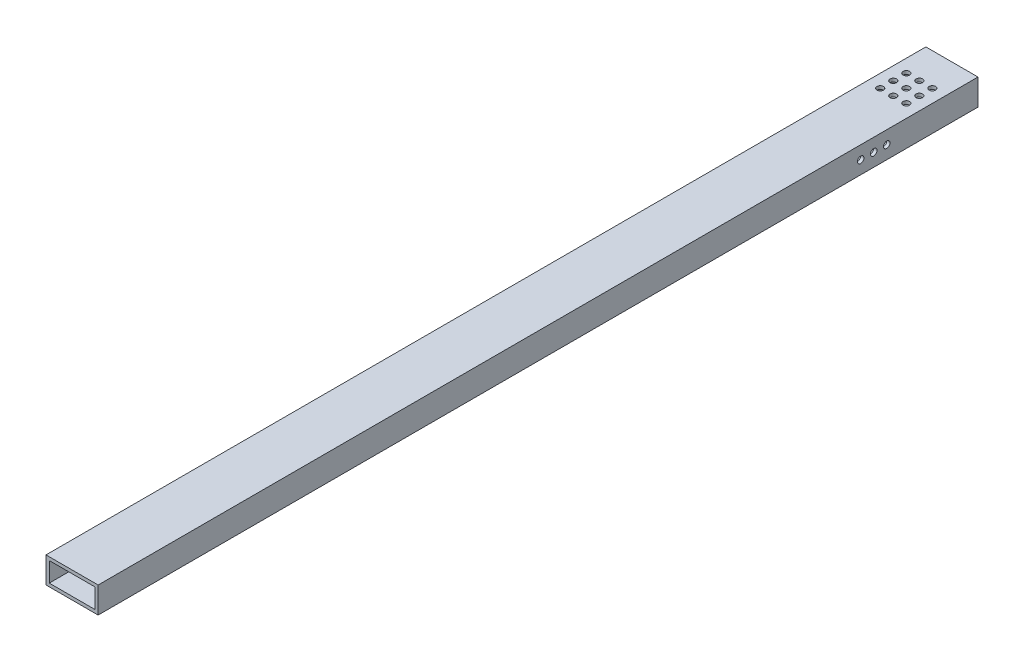
from build123d import *

# Parameters (mm, degrees)
SKETCH1_W               = 50.8
SKETCH1_H               = 25.4
SKETCH1_W_2             = 44.45
SKETCH1_H_2             = 19.05
BOSS_EXTRUDE1_DEPTH     = 857.25
CUT_EXTRUDE1_DEPTH      = 860.129421275
CUT_EXTRUDE1_DEPTH_BACK = 860.129421275
SKETCH2_R               = 3.175
CUT_EXTRUDE2_DEPTH      = 860.129421275
CUT_EXTRUDE2_DEPTH_BACK = 860.129421275
SKETCH3_R               = 3.175


with BuildPart() as part:
    # Sketch1 → Boss-Extrude1 (new body)
    with BuildSketch(Plane.XY):
        with Locations((25.4, 12.7)):
            Rectangle(SKETCH1_W, SKETCH1_H)
        with Locations((25.4, 12.7)):
            Rectangle(SKETCH1_W_2, SKETCH1_H_2, mode=Mode.SUBTRACT)
    extrude(amount=BOSS_EXTRUDE1_DEPTH)

    # Sketch2 → Cut-Extrude1 (cut, two sides: drawn at the far end of the back side and taken through both)
    with BuildSketch(Plane(origin=(50.8, 0, 0), x_dir=(0, 0, -1), z_dir=(1, 0, 0)).offset(-CUT_EXTRUDE1_DEPTH_BACK)):
        with Locations((-88.9, 12.7)):
            Circle(SKETCH2_R)
        with Locations((-101.6, 12.7)):
            Circle(SKETCH2_R)
        with Locations((-114.3, 12.7)):
            Circle(SKETCH2_R)
    extrude(amount=CUT_EXTRUDE1_DEPTH + CUT_EXTRUDE1_DEPTH_BACK, mode=Mode.SUBTRACT)

    # Sketch3 → Cut-Extrude2 (cut, two sides: drawn at the far end of the back side and taken through both)
    with BuildSketch(Plane(origin=(0, 25.4, 0), x_dir=(1, 0, 0), z_dir=(0, 1, 0)).offset(-CUT_EXTRUDE2_DEPTH_BACK)):
        with Locations(Location((12.7, -31.75, 0), (0, 0, 270))):
            Circle(SKETCH3_R)
        with Locations(Location((25.4, -31.75, 0), (0, 0, 270))):
            Circle(SKETCH3_R)
        with Locations(Location((38.1, -31.75, 0), (0, 0, 270))):
            Circle(SKETCH3_R)
        with Locations(Location((25.4, -44.45, 0), (0, 0, 270))):
            Circle(SKETCH3_R)
        with Locations(Location((38.1, -44.45, 0), (0, 0, 270))):
            Circle(SKETCH3_R)
        with Locations(Location((25.4, -57.15, 0), (0, 0, 270))):
            Circle(SKETCH3_R)
        with Locations(Location((38.1, -57.15, 0), (0, 0, 270))):
            Circle(SKETCH3_R)
        with Locations(Location((12.7, -44.45, 0), (0, 0, 270))):
            Circle(SKETCH3_R)
        with Locations(Location((12.7, -57.15, 0), (0, 0, 270))):
            Circle(SKETCH3_R)
    extrude(amount=CUT_EXTRUDE2_DEPTH + CUT_EXTRUDE2_DEPTH_BACK, mode=Mode.SUBTRACT)


solid = part.part
